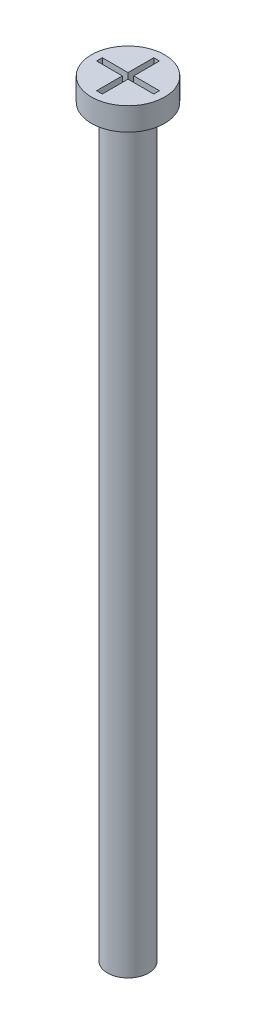
from build123d import *

# Parameters (mm, degrees)
SKETCH2_W          = 0.25
SKETCH2_H          = 1.125
SKETCH2_W_2        = 1.125
SKETCH2_H_2        = 0.25
CUT_EXTRUDE1_DEPTH = 0.5


with BuildPart() as part:
    # Sketch1 → Revolve1 (revolve)
    with BuildSketch(Plane.XY, mode=Mode.PRIVATE) as revolve1_sk:
        Polygon((0, 0), (1.6, 0), (1.6, -1), (0.9, -1), (0.9, -33.5), (0, -33.5), align=None)
    revolve(revolve1_sk.sketch.rotate(Axis((0, -33.5, 0), (0, 1, 0)), 90), axis=Axis((0, -33.5, 0), (0, 1, 0)))

    # Sketch2 → Cut-Extrude1 (cut)
    with BuildSketch(Plane(origin=(0, 0, 0), x_dir=(1, 0, 0), z_dir=(0, 1, 0))):
        with Locations((0, -0.6875)):
            Rectangle(SKETCH2_W, SKETCH2_H)
        with Locations((-0.6875, 0)):
            Rectangle(SKETCH2_W_2, SKETCH2_H_2)
        with Locations((0, 0.6875)):
            Rectangle(SKETCH2_W, SKETCH2_H)
        with Locations((0.6875, 0)):
            Rectangle(SKETCH2_W_2, SKETCH2_H_2)
        Rectangle(SKETCH2_W, SKETCH2_H_2)
    extrude(amount=-CUT_EXTRUDE1_DEPTH, mode=Mode.SUBTRACT)


solid = part.part
